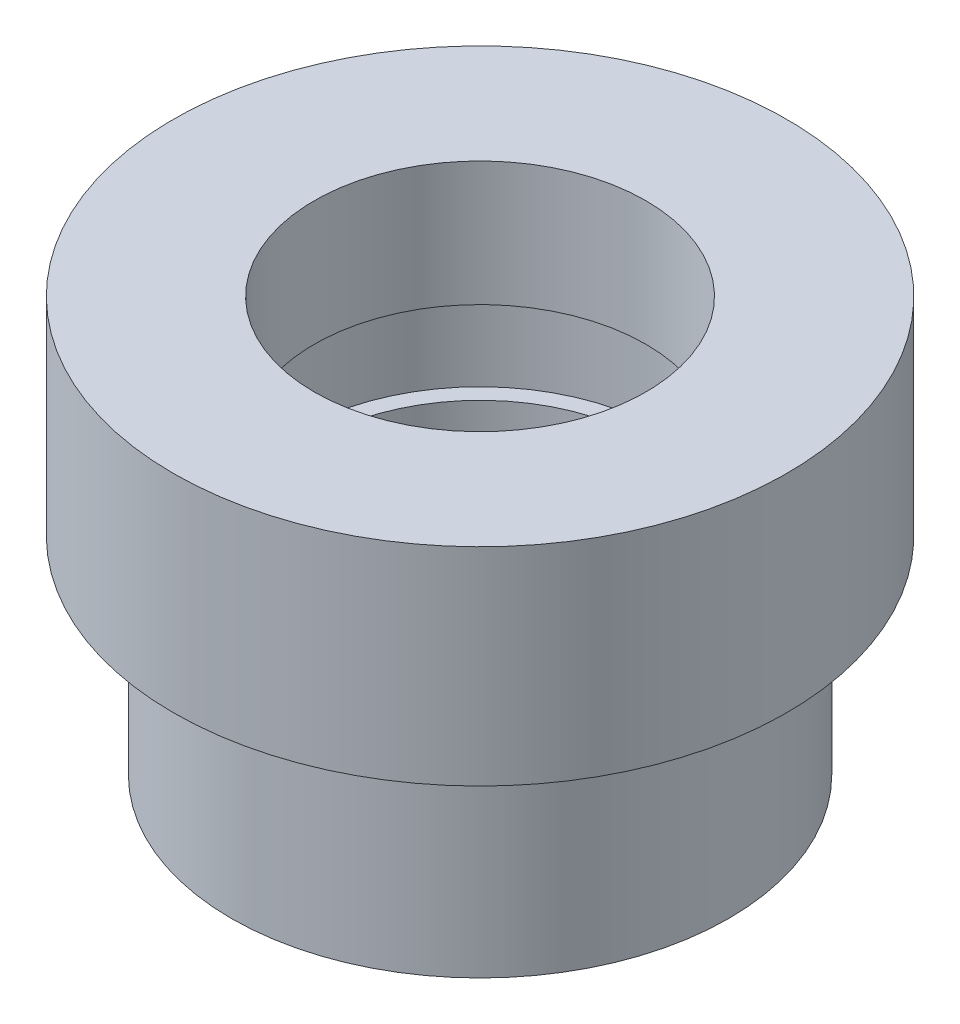
from build123d import *


with BuildPart() as part:
    # Sketch1 → Revolve1 (revolve)
    with BuildSketch(Plane.XY, mode=Mode.PRIVATE) as revolve1_sk:
        Polygon((-37, 50), (-20, 50), (-20, 35), (-22, 35), (-22, 25), (-20, 25), (-20, 0), (-30, 0), (-30, 25), (-37, 25), align=None)
    revolve(revolve1_sk.sketch.rotate(Axis((0, 23.737864078, 0), (0, -1, 0)), 270), axis=Axis((0, 23.737864078, 0), (0, -1, 0)))


solid = part.part
